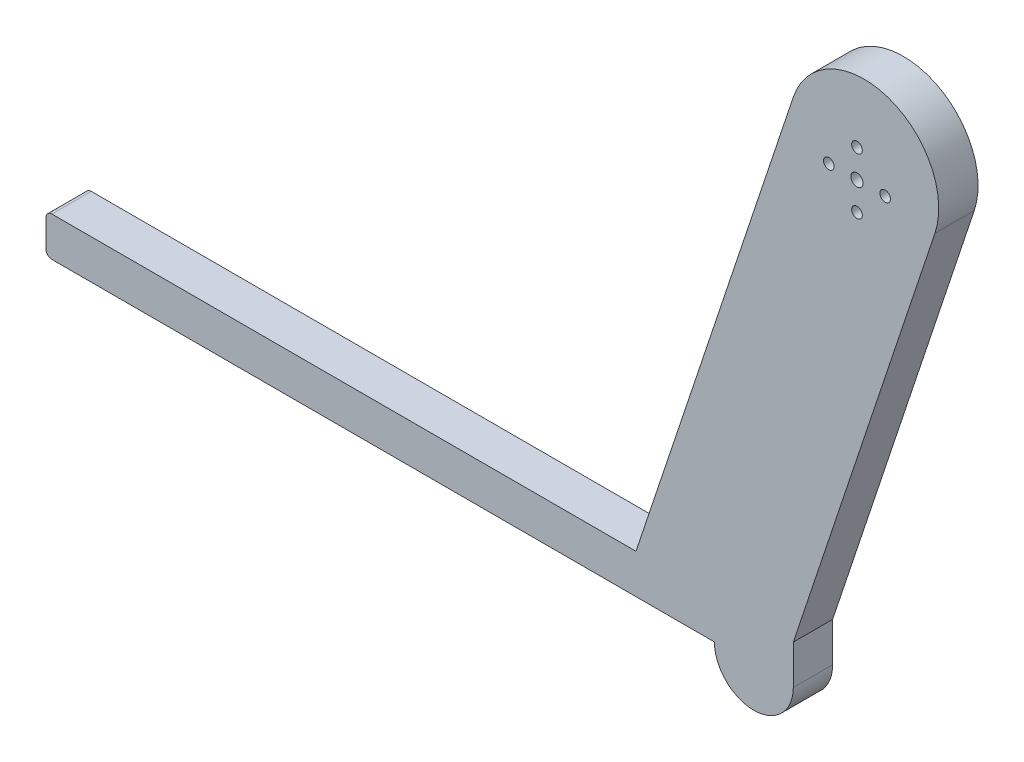
from build123d import *

# Parameters (mm, degrees)
EXTRUDE_1_DEPTH     = 10
EXTRUDE_2_DEPTH     = 10
SKETCH_1_8_R        = 1.35
CUT_EXTRUDE_1_DEPTH = 10
SKETCH_1_9_R        = 1.55
CUT_EXTRUDE_2_DEPTH = 10
SKETCH_1_10_R       = 9.8
CUT_EXTRUDE_3_DEPTH = 2


with BuildPart() as part:
    # 草图1 → 凸台-拉伸1 (new body)
    with BuildSketch(Plane.XY):
        with BuildLine():
            Line((-150, -1.5), (-150, -8.5))
            ThreePointArc((-150, -8.5), (-149.560660172, -9.560660172), (-148.5, -10))
            Line((-148.5, -10), (19.937196429, -10))
            ThreePointArc((19.937196429, -10), (29.968598214, -20.031401786), (40, -10))
            Line((40, -10), (40, -8.5))
            Line((40, -8.5), (40, 0))
            Line((40, 0), (-148.5, 0))
            ThreePointArc((-148.5, 0), (-149.560660172, -0.439339828), (-150, -1.5))
        make_face()
    extrude(amount=EXTRUDE_1_DEPTH)

    # 草图1<6> → 凸台-拉伸2 (add)
    with BuildSketch(Plane.XY):
        with BuildLine():
            Line((0, 0), (40, 120))
            ThreePointArc((40, 120), (64, 132), (76, 108))
            Line((76, 108), (40, 0))
            Line((40, 0), (0, 0))
        make_face()
    extrude(amount=EXTRUDE_2_DEPTH)

    # 草图1<8> → 切除-拉伸1 (cut)
    with BuildSketch(Plane.XY):
        with Locations((63.349864231, 109.872544891)):
            Circle(SKETCH_1_8_R)
        with Locations((56.190864231, 117.031544891)):
            Circle(SKETCH_1_8_R)
        with Locations((56.190864231, 102.713544891)):
            Circle(SKETCH_1_8_R)
        with Locations((49.031864231, 109.872544891)):
            Circle(SKETCH_1_8_R)
    extrude(amount=CUT_EXTRUDE_1_DEPTH, mode=Mode.SUBTRACT)

    # 草图1<9> → 切除-拉伸2 (cut)
    with BuildSketch(Plane.XY):
        with Locations((56.190864231, 109.872544891)):
            Circle(SKETCH_1_9_R)
    extrude(amount=CUT_EXTRUDE_2_DEPTH, mode=Mode.SUBTRACT)

    # 草图1<10> → 切除-拉伸3 (cut)
    with BuildSketch(Plane.XY):
        with Locations((56.190864231, 109.872544891)):
            Circle(SKETCH_1_10_R)
    extrude(amount=CUT_EXTRUDE_3_DEPTH, mode=Mode.SUBTRACT)


solid = part.part
